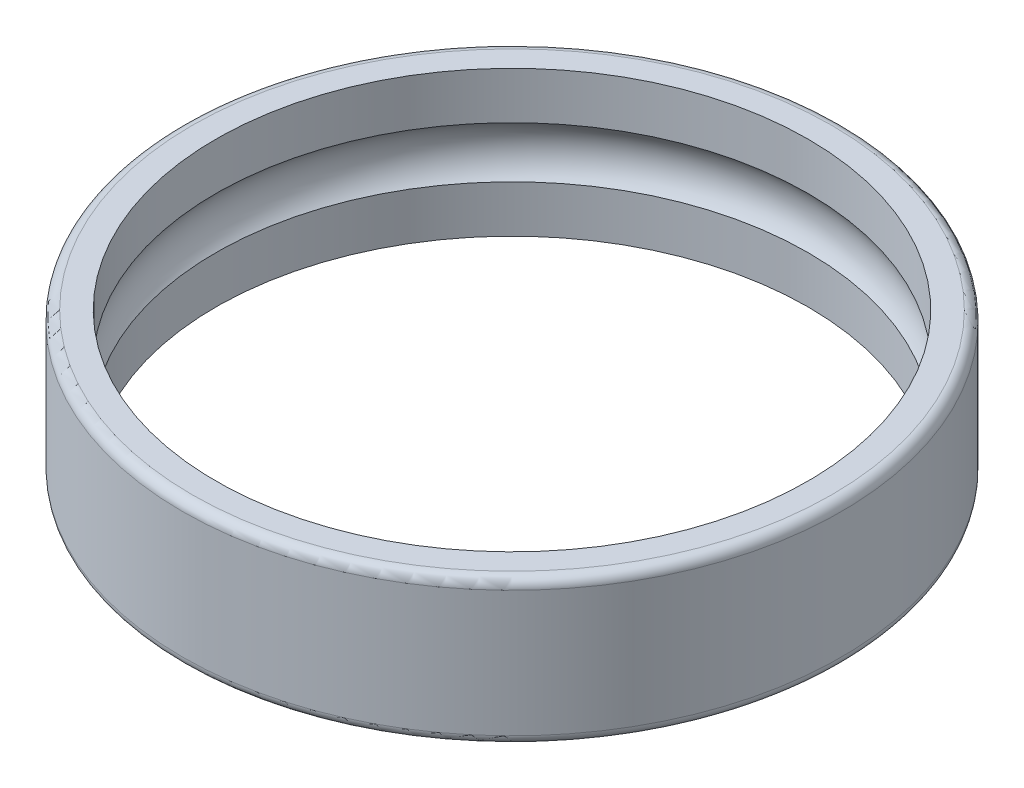
from build123d import *

# Parameters (mm, degrees)
FILLET1_R = 1


with BuildPart() as part:
    # Sketch1 → Revolve1 (revolve)
    with BuildSketch(Plane.XY, mode=Mode.PRIVATE) as revolve1_sk:
        with BuildLine():
            Line((-34, 0), (-30.55, 0))
            Line((-30.55, 0), (-30.55, 4.859058821))
            ThreePointArc((-30.55, 4.859058821), (-31.55625, 7.5), (-30.55, 10.140941179))
            Line((-30.55, 10.140941179), (-30.55, 15))
            Line((-30.55, 15), (-34, 15))
            Line((-34, 15), (-34, 0))
        make_face()
    revolve(revolve1_sk.sketch.rotate(Axis((0, 0, 0), (0, 1, 0)), 270), axis=Axis((0, 0, 0), (0, 1, 0)))

    # Fillet1
    fillet1_edges = [part.edges().sort_by_distance(p)[0] for p in [
        (0, 0, 34),
        (0, 15, 34),
    ]]
    fillet(fillet1_edges, radius=FILLET1_R)


solid = part.part
